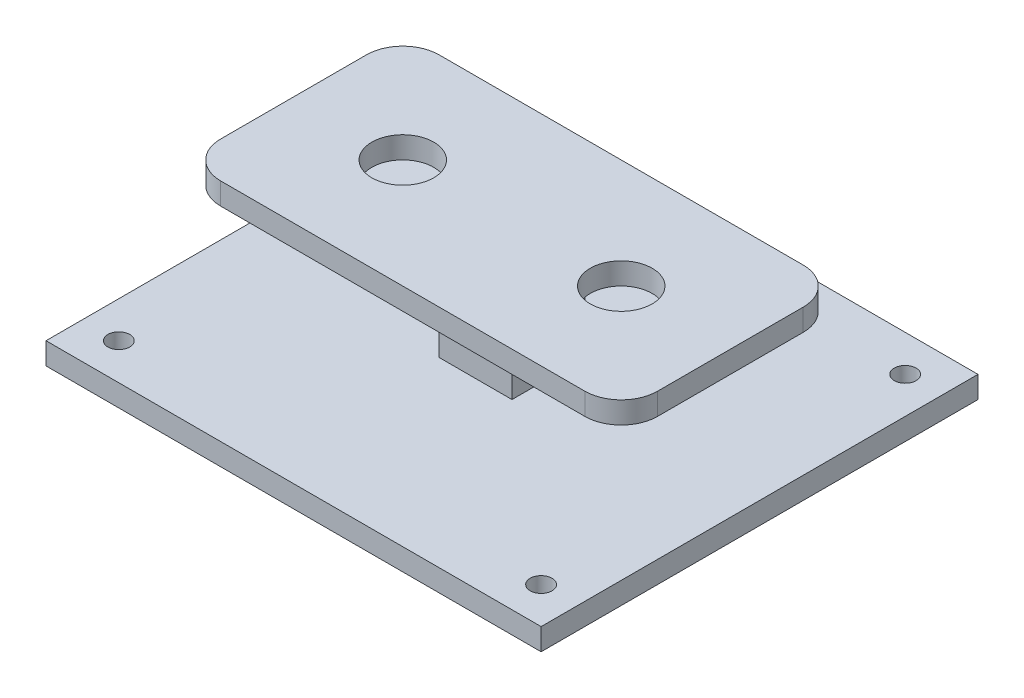
from build123d import *

# Parameters (mm, degrees)
CROQUIS1_W              = 68
CROQUIS1_H              = 60
CROQUIS1_R              = 1.5
SALIENTE_EXTRUIR2_DEPTH = 3
CROQUIS2_W              = 5
CROQUIS2_H              = 10
SALIENTE_EXTRUIR3_DEPTH = 13
CORTAR_EXTRUIR1_DEPTH   = 13
CROQUIS4_R              = 1.5
CORTAR_EXTRUIR2_DEPTH   = 13
CROQUIS6_W              = 0.75
CROQUIS6_H              = 19.11
CROQUIS6_H_2            = 18.27
CORTAR_EXTRUIR3_DEPTH   = 10
CROQUIS7_W              = 7.48396125
CROQUIS7_H              = 18.688270588
CORTAR_EXTRUIR4_DEPTH   = 10
CROQUIS8_W              = 10
CROQUIS8_H              = 10
SALIENTE_EXTRUIR4_DEPTH = 13
CROQUIS9_W              = 60
CROQUIS9_H              = 30
SALIENTE_EXTRUIR5_DEPTH = 3
CROQUIS10_R             = 4.25
CORTAR_EXTRUIR5_DEPTH   = 3
REDONDEO1_R             = 5


with BuildPart() as part:
    # Croquis1 → Saliente-Extruir2 (new body)
    with BuildSketch(Plane(origin=(0, 0, 0), x_dir=(1, 0, 0), z_dir=(0, 1, 0))):
        Rectangle(CROQUIS1_W, CROQUIS1_H)
        with Locations(Location((-29, 25, 0), (0, 0, 270))):
            Circle(CROQUIS1_R, mode=Mode.SUBTRACT)
        with Locations(Location((29, 25, 0), (0, 0, 270))):
            Circle(CROQUIS1_R, mode=Mode.SUBTRACT)
        with Locations(Location((-29, -25, 0), (0, 0, 270))):
            Circle(CROQUIS1_R, mode=Mode.SUBTRACT)
        with Locations(Location((29, -25, 0), (0, 0, 270))):
            Circle(CROQUIS1_R, mode=Mode.SUBTRACT)
    extrude(amount=SALIENTE_EXTRUIR2_DEPTH)

    # Croquis2 → Saliente-Extruir3 (add)
    with BuildSketch(Plane(origin=(0, 3, 0), x_dir=(1, 0, 0), z_dir=(0, 1, 0))):
        Rectangle(CROQUIS2_W, CROQUIS2_H)
    extrude(amount=SALIENTE_EXTRUIR3_DEPTH)

    # Croquis3 → Cortar-Extruir1 (cut)
    with BuildSketch(Plane(origin=(2.5, 0, 0), x_dir=(0, 0, -1), z_dir=(1, 0, 0))):
        with BuildLine():
            Line((-5, 16), (-5, 11))
            ThreePointArc((-5, 11), (-3.535533906, 14.535533906), (0, 16))
            Line((0, 16), (-5, 16))
        make_face()
        with BuildLine():
            ThreePointArc((0, 16), (3.535533906, 14.535533906), (5, 11))
            Line((5, 11), (5, 16))
            Line((5, 16), (0, 16))
        make_face()
    extrude(amount=-CORTAR_EXTRUIR1_DEPTH, mode=Mode.SUBTRACT)

    # Croquis4 → Cortar-Extruir2 (cut)
    with BuildSketch(Plane(origin=(2.5, 0, 0), x_dir=(0, 0, -1), z_dir=(1, 0, 0))):
        with Locations((0, 11)):
            Circle(CROQUIS4_R)
    extrude(amount=-CORTAR_EXTRUIR2_DEPTH, mode=Mode.SUBTRACT)

    # Croquis6 → Cortar-Extruir3 (cut)
    with BuildSketch(Plane(origin=(0, 0, -5), x_dir=(-1, 0, 0), z_dir=(0, 0, -1))):
        with Locations((-2.125, 12.555)):
            Rectangle(CROQUIS6_W, CROQUIS6_H)
        with Locations((2.125, 12.135)):
            Rectangle(CROQUIS6_W, CROQUIS6_H_2)
    extrude(amount=-CORTAR_EXTRUIR3_DEPTH, mode=Mode.SUBTRACT)

    # Croquis7 → Cortar-Extruir4 (cut)
    with BuildSketch(Plane(origin=(0, 0, -5), x_dir=(-1, 0, 0), z_dir=(0, 0, -1))):
        with Locations((1.991980625, 12.344135294)):
            Rectangle(CROQUIS7_W, CROQUIS7_H)
    extrude(amount=-CORTAR_EXTRUIR4_DEPTH, mode=Mode.SUBTRACT)

    # Croquis8 → Saliente-Extruir4 (add)
    with BuildSketch(Plane(origin=(0, 3, 0), x_dir=(1, 0, 0), z_dir=(0, 1, 0))):
        Rectangle(CROQUIS8_W, CROQUIS8_H)
    extrude(amount=SALIENTE_EXTRUIR4_DEPTH)

    # Croquis9 → Saliente-Extruir5 (add)
    with BuildSketch(Plane(origin=(0, 16, 0), x_dir=(1, 0, 0), z_dir=(0, 1, 0))):
        Rectangle(CROQUIS9_W, CROQUIS9_H)
    extrude(amount=SALIENTE_EXTRUIR5_DEPTH)

    # Croquis10 → Cortar-Extruir5 (cut)
    with BuildSketch(Plane(origin=(0, 19, 0), x_dir=(1, 0, 0), z_dir=(0, 1, 0))):
        with Locations(Location((-15, 0, 0), (0, 0, 270))):
            Circle(CROQUIS10_R)
        with Locations(Location((15, 0, 0), (0, 0, 270))):
            Circle(CROQUIS10_R)
    extrude(amount=-CORTAR_EXTRUIR5_DEPTH, mode=Mode.SUBTRACT)

    # Redondeo1
    redondeo1_edges = [part.edges().sort_by_distance(p)[0] for p in [
        (30, 17.5, 15),
        (30, 17.5, -15),
        (-30, 17.5, -15),
        (-30, 17.5, 15),
    ]]
    fillet(redondeo1_edges, radius=REDONDEO1_R)


solid = part.part
